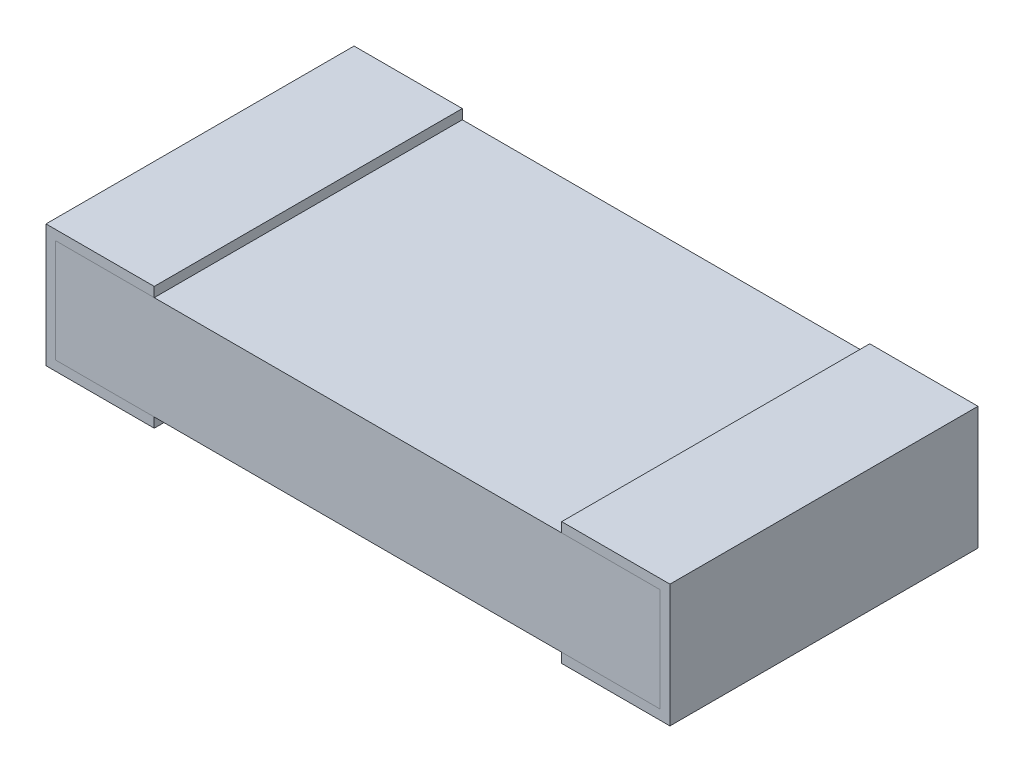
from build123d import *

# Parameters (mm, degrees)
SKETCH1_W             = 3.1
SKETCH1_H             = 0.53
BOSS_EXTRUDE1_DEPTH   = 1.58
BOSS_EXTRUDE2_DEPTH   = 1.58
BOSS_EXTRUDE2_2_DEPTH = 1.58


with BuildPart() as part:
    # Sketch1 → Boss-Extrude1 (new body)
    with BuildSketch(Plane.XY):
        with Locations((1.55, 0.265)):
            Rectangle(SKETCH1_W, SKETCH1_H)
    extrude(amount=BOSS_EXTRUDE1_DEPTH)


with BuildPart() as body_2:
    # Sketch2 → Boss-Extrude2 (new body)
    with BuildSketch(Plane.XY.offset(1.58)):
        Polygon((2.594858091, 0.53), (2.594858091, 0.58), (3.15, 0.58), (3.15, -0.05), (2.594858091, -0.05), (2.594858091, 0), (3.1, 0), (3.1, 0.53), align=None)
    extrude(amount=-BOSS_EXTRUDE2_DEPTH)


with BuildPart() as body_3:
    # Sketch2 → Boss-Extrude2 2 (new body)
    with BuildSketch(Plane.XY.offset(1.58)):
        Polygon((0, 0), (0, 0.53), (0.505141909, 0.53), (0.505141909, 0.58), (-0.05, 0.58), (-0.05, -0.05), (0.505141909, -0.05), (0.505141909, 0), align=None)
    extrude(amount=-BOSS_EXTRUDE2_2_DEPTH)


solid = Compound([part.part, body_2.part, body_3.part])
